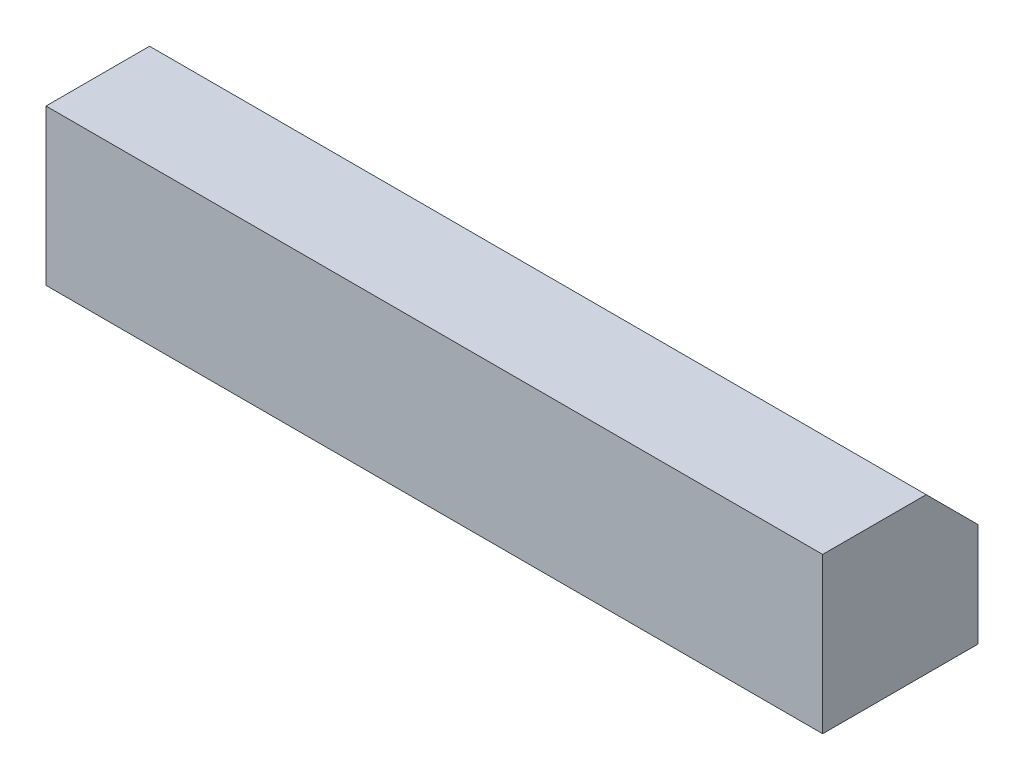
from build123d import *

# Parameters (mm, degrees)
SKETCH_1_W      = 15
SKETCH_1_H      = 3
EXTRUDE_1_DEPTH = 3
CHAMFER_1_SIZE  = 1


with BuildPart() as part:
    # Эскиз1 → Бобышка-Вытянуть1 (new body)
    with BuildSketch(Plane(origin=(0, 0, 0), x_dir=(1, 0, 0), z_dir=(0, 1, 0))):
        Rectangle(SKETCH_1_W, SKETCH_1_H)
    extrude(amount=EXTRUDE_1_DEPTH)

    # Фаска1
    chamfer_1_edges = [part.edges().sort_by_distance(p)[0] for p in [
        (0, 3, -1.5),
    ]]
    chamfer(chamfer_1_edges, length=CHAMFER_1_SIZE)


solid = part.part
